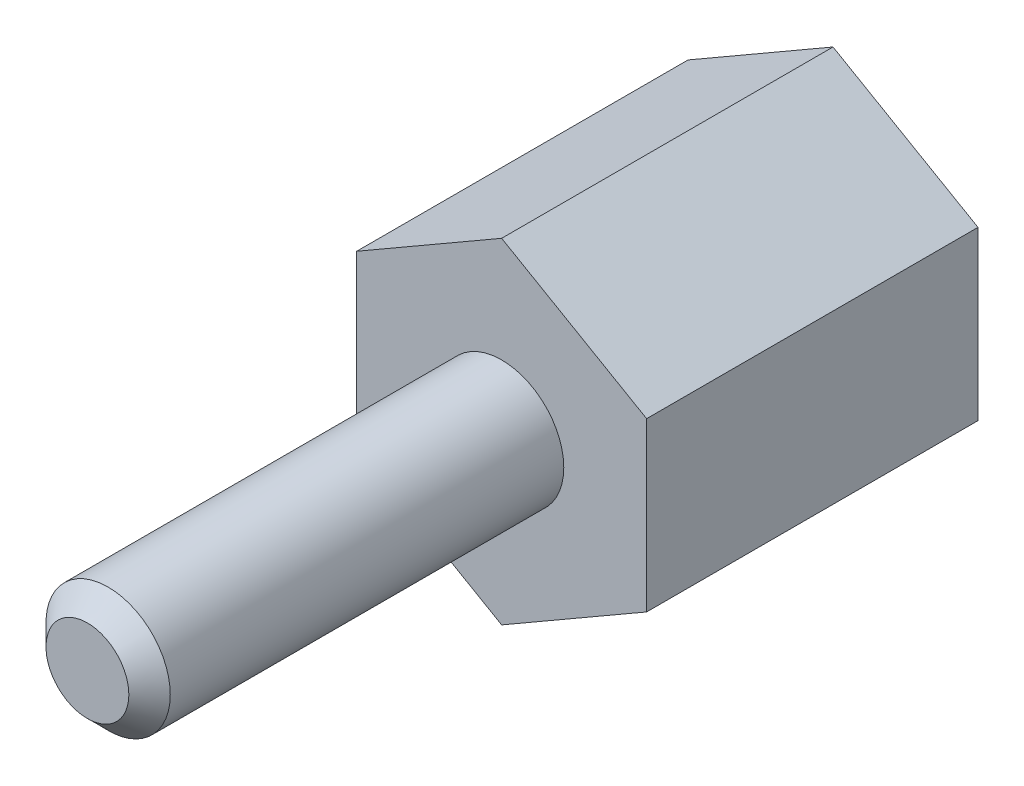
from build123d import *

# Parameters (mm, degrees)
EXTRUDE_1_DEPTH     = 8
SKETCH_2_R          = 1.5
EXTRUDE_2_DEPTH     = 10
M3X0_51_D           = 2.5
M3X0_51_DEPTH       = 6
M3X0_51_CSINK_D     = 3
M3X0_51_CSINK_ANGLE = 90
M3X0_51_TIP         = 0.751075774
CHAMFER_1_SIZE      = 0.5


with BuildPart() as part:
    # Эскиз1 → Вытянуть1 (new body)
    with BuildSketch(Plane.XY):
        Polygon((0, 4.041451884), (-3.5, 2.020725942), (-3.5, -2.020725942), (0, -4.041451884), (3.5, -2.020725942), (3.5, 2.020725942), align=None)
    extrude(amount=EXTRUDE_1_DEPTH)

    # Эскиз2 → Вытянуть2 (add)
    with BuildSketch(Plane.XY.offset(8)):
        Circle(SKETCH_2_R)
    extrude(amount=EXTRUDE_2_DEPTH)

    # Сверление под метчик M3x0.51
    with Locations(Plane(origin=(0, 0, 0), x_dir=(-1, 0, 0), z_dir=(0, 0, -1))):
        with Locations((0, 0)):
            CounterSinkHole(M3X0_51_D / 2, M3X0_51_CSINK_D / 2, depth=M3X0_51_DEPTH, counter_sink_angle=M3X0_51_CSINK_ANGLE)
            with Locations((0, 0, -(M3X0_51_DEPTH + M3X0_51_TIP / 2))):  # 118° drill point
                Cone(0, M3X0_51_D / 2, M3X0_51_TIP, mode=Mode.SUBTRACT)

    # Фаска1
    chamfer_1_edges = [part.edges().sort_by_distance(p)[0] for p in [
        (-1.5, 0, 18),
    ]]
    chamfer(chamfer_1_edges, length=CHAMFER_1_SIZE)


solid = part.part
